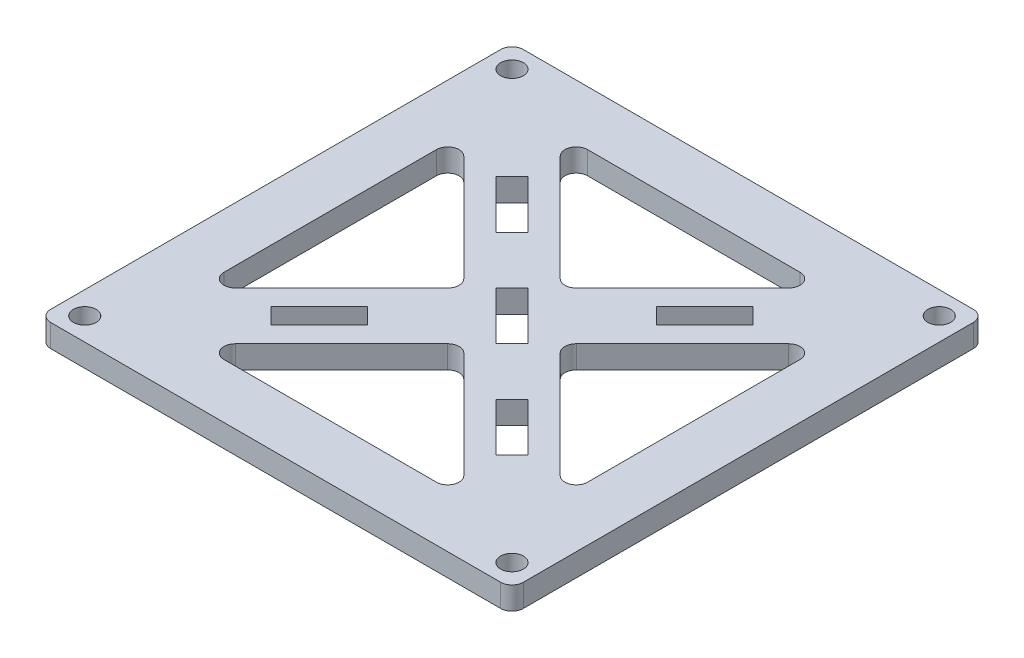
from build123d import *

# Parameters (mm, degrees)
SKETCH1_R           = 1.5875
BOSS_EXTRUDE1_DEPTH = 3.175


with BuildPart() as part:
    # Sketch1 → Boss-Extrude1 (new body)
    with BuildSketch(Plane(origin=(0, 0, 0), x_dir=(1, 0, 0), z_dir=(0, 1, 0))):
        with BuildLine():
            Line((-31.4325, 33.02), (31.4325, 33.02))
            ThreePointArc((31.4325, 33.02), (32.555032015, 32.555032015), (33.02, 31.4325))
            Line((33.02, 31.4325), (33.02, -31.4325))
            ThreePointArc((33.02, -31.4325), (32.555032015, -32.555032015), (31.4325, -33.02))
            Line((31.4325, -33.02), (-31.4325, -33.02))
            ThreePointArc((-31.4325, -33.02), (-32.555032015, -32.555032015), (-33.02, -31.4325))
            Line((-33.02, -31.4325), (-33.02, 31.4325))
            ThreePointArc((-33.02, 31.4325), (-32.555032015, 32.555032015), (-31.4325, 33.02))
        make_face()
        with Locations(Location((-29.845, 29.845, 0), (0, 0, 270))):
            Circle(SKETCH1_R, mode=Mode.SUBTRACT)
        with Locations(Location((29.845, 29.845, 0), (0, 0, 270))):
            Circle(SKETCH1_R, mode=Mode.SUBTRACT)
        with Locations(Location((29.845, -29.845, 0), (0, 0, 270))):
            Circle(SKETCH1_R, mode=Mode.SUBTRACT)
        with Locations(Location((-29.845, -29.845, 0), (0, 0, 270))):
            Circle(SKETCH1_R, mode=Mode.SUBTRACT)
        with BuildLine():
            Line((-14.832243879, 25.4), (14.832243879, 25.4))
            ThreePointArc((14.832243879, 25.4), (16.298902637, 24.420009949), (15.954775894, 22.689967985))
            Line((15.954775894, 22.689967985), (1.122532015, 7.857724106))
            ThreePointArc((1.122532015, 7.857724106), (0, 7.392756121), (-1.122532015, 7.857724106))
            Line((-1.122532015, 7.857724106), (-15.954775894, 22.689967985))
            ThreePointArc((-15.954775894, 22.689967985), (-16.298902637, 24.420009949), (-14.832243879, 25.4))
        make_face(mode=Mode.SUBTRACT)
        Polygon((15.715448212, -17.960512242), (17.960512242, -15.715448212), (11.225320151, -8.980256121), (8.980256121, -11.225320151), align=None, mode=Mode.SUBTRACT)
        with BuildLine():
            Line((-14.832243879, -25.4), (14.832243879, -25.4))
            ThreePointArc((14.832243879, -25.4), (16.298902637, -24.420009949), (15.954775894, -22.689967985))
            Line((15.954775894, -22.689967985), (1.122532015, -7.857724106))
            ThreePointArc((1.122532015, -7.857724106), (0, -7.392756121), (-1.122532015, -7.857724106))
            Line((-1.122532015, -7.857724106), (-15.954775894, -22.689967985))
            ThreePointArc((-15.954775894, -22.689967985), (-16.298902637, -24.420009949), (-14.832243879, -25.4))
        make_face(mode=Mode.SUBTRACT)
        Polygon((-15.715448212, 17.960512242), (-8.980256121, 11.225320151), (-11.225320151, 8.980256121), (-17.960512242, 15.715448212), align=None, mode=Mode.SUBTRACT)
        Polygon((-17.960512242, -15.715448212), (-11.225320151, -8.980256121), (-8.980256121, -11.225320151), (-15.715448212, -17.960512242), align=None, mode=Mode.SUBTRACT)
        with BuildLine():
            Line((-22.689967985, 15.954775894), (-7.857724106, 1.122532015))
            ThreePointArc((-7.857724106, 1.122532015), (-7.392756121, 0), (-7.857724106, -1.122532015))
            Line((-7.857724106, -1.122532015), (-22.689967985, -15.954775894))
            ThreePointArc((-22.689967985, -15.954775894), (-24.420009949, -16.298902637), (-25.4, -14.832243879))
            Line((-25.4, -14.832243879), (-25.4, 14.832243879))
            ThreePointArc((-25.4, 14.832243879), (-24.420009949, 16.298902637), (-22.689967985, 15.954775894))
        make_face(mode=Mode.SUBTRACT)
        Polygon((-4.490128061, 2.24506403), (-2.24506403, 4.490128061), (4.490128061, -2.24506403), (2.24506403, -4.490128061), align=None, mode=Mode.SUBTRACT)
        Polygon((8.980256121, 11.225320151), (15.715448212, 17.960512242), (17.960512242, 15.715448212), (11.225320151, 8.980256121), align=None, mode=Mode.SUBTRACT)
        with BuildLine():
            Line((25.4, -14.832243879), (25.4, 14.832243879))
            ThreePointArc((25.4, 14.832243879), (24.420009949, 16.298902637), (22.689967985, 15.954775894))
            Line((22.689967985, 15.954775894), (7.857724106, 1.122532015))
            ThreePointArc((7.857724106, 1.122532015), (7.392756121, 0), (7.857724106, -1.122532015))
            Line((7.857724106, -1.122532015), (22.689967985, -15.954775894))
            ThreePointArc((22.689967985, -15.954775894), (24.420009949, -16.298902637), (25.4, -14.832243879))
        make_face(mode=Mode.SUBTRACT)
    extrude(amount=BOSS_EXTRUDE1_DEPTH)


solid = part.part
